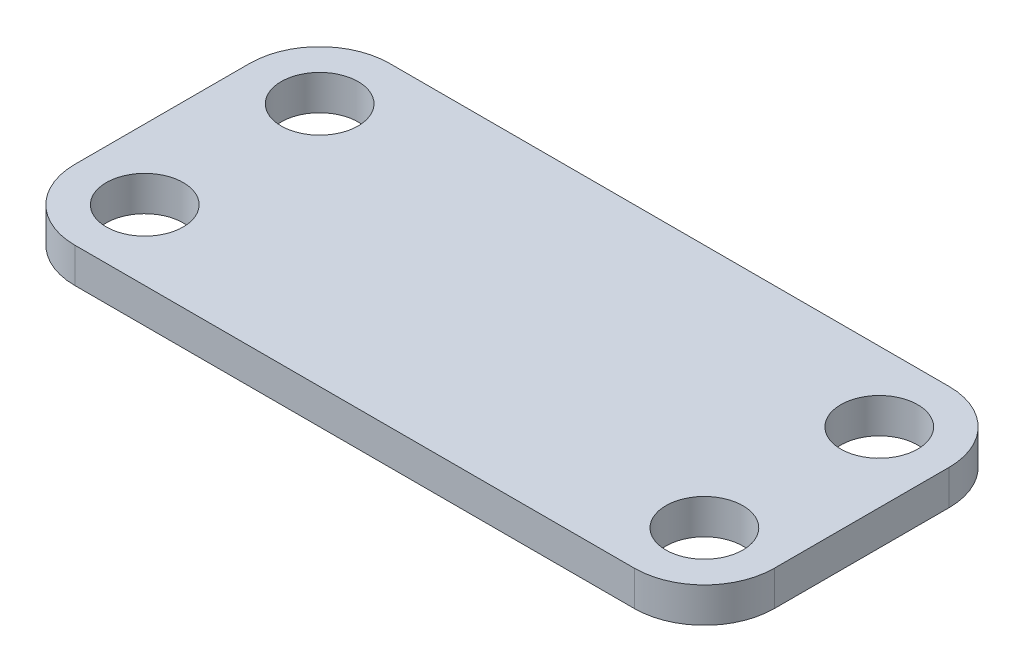
from build123d import *

# Parameters (mm, degrees)
SKETCH_1_W             = 20
SKETCH_1_H             = 9
EXTRUDE_1_DEPTH        = 1
HOLE_WIZARD_M2_1_D     = 2.2
HOLE_WIZARD_M2_1_DEPTH = 7.5
HOLE_WIZARD_M2_1_TIP   = 0.660946681
FILLET_1_R             = 2


with BuildPart() as part:
    # 草图1 → 凸台-拉伸1 (new body)
    with BuildSketch(Plane(origin=(0, 0, 0), x_dir=(1, 0, 0), z_dir=(0, 1, 0))):
        Rectangle(SKETCH_1_W, SKETCH_1_H)
    extrude(amount=EXTRUDE_1_DEPTH)

    # M2 间隙孔1
    with Locations(Plane(origin=(0, 1, 0), x_dir=(1, 0, 0), z_dir=(0, 1, 0))):
        with Locations((-8, 2.5), (8, 2.5), (8, -2.5), (-8, -2.5)):
            Hole(HOLE_WIZARD_M2_1_D / 2, depth=HOLE_WIZARD_M2_1_DEPTH)
            with Locations((0, 0, -(HOLE_WIZARD_M2_1_DEPTH + HOLE_WIZARD_M2_1_TIP / 2))):  # 118° drill point
                Cone(0, HOLE_WIZARD_M2_1_D / 2, HOLE_WIZARD_M2_1_TIP, mode=Mode.SUBTRACT)

    # 圆角1
    fillet_1_edges = [part.edges().sort_by_distance(p)[0] for p in [
        (10, 0.5, 4.5),
        (-10, 0.5, 4.5),
        (-10, 0.5, -4.5),
        (10, 0.5, -4.5),
    ]]
    fillet(fillet_1_edges, radius=FILLET_1_R)


solid = part.part
